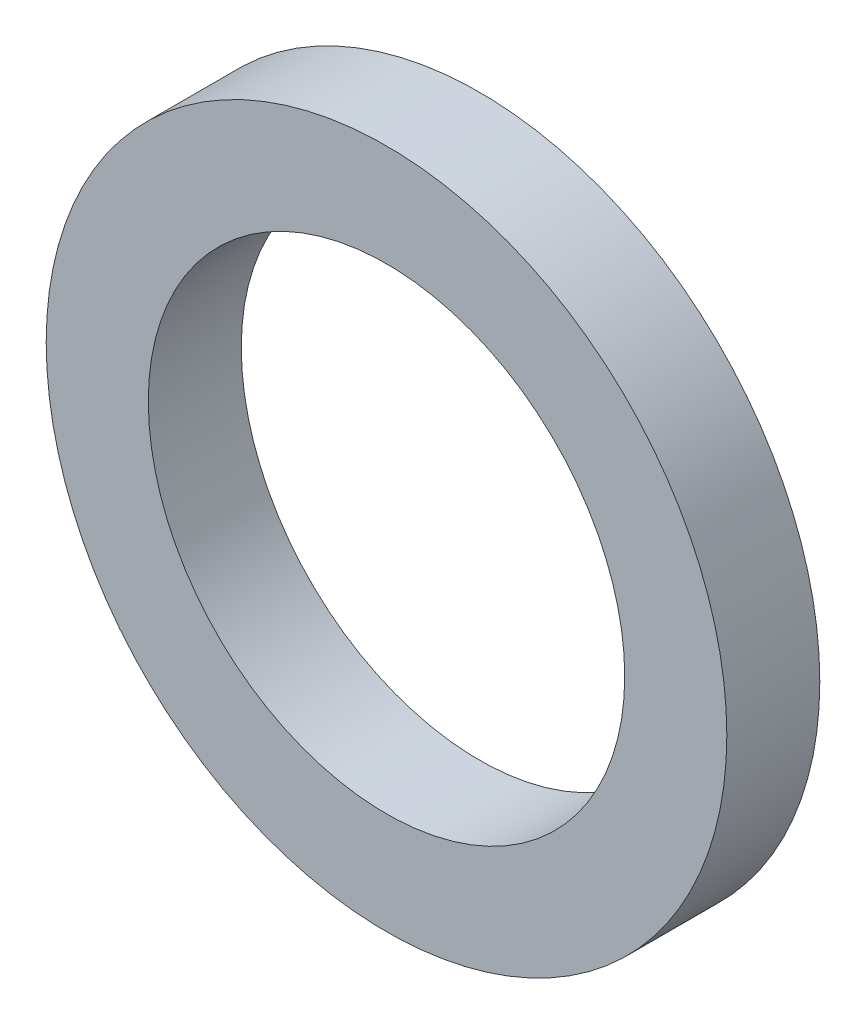
from build123d import *

# Parameters (mm, degrees)
ESQUISSE1_R        = 25
ESQUISSE1_R_2      = 17.5
BOSS_EXTRU_1_DEPTH = 6.83


with BuildPart() as part:
    # Esquisse1 → Boss.-Extru.1 (new body)
    with BuildSketch(Plane.XY):
        Circle(ESQUISSE1_R)
        Circle(ESQUISSE1_R_2, mode=Mode.SUBTRACT)
    extrude(amount=BOSS_EXTRU_1_DEPTH)


solid = part.part
